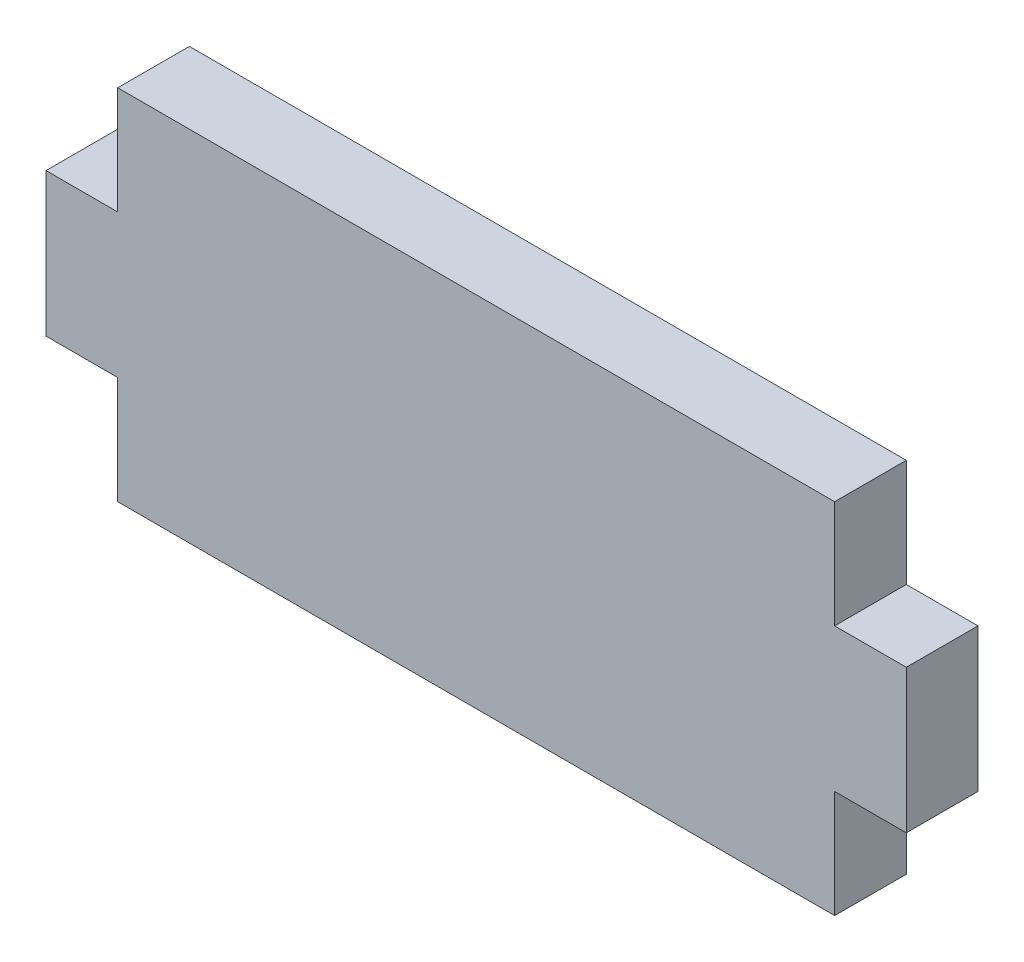
from build123d import *

# Parameters (mm, degrees)
ESQUISSE1_W        = 10
ESQUISSE1_H        = 20
ESQUISSE1_W_2      = 100
ESQUISSE1_H_2      = 50
BOSS_EXTRU_1_DEPTH = 10


with BuildPart() as part:
    # Esquisse1 → Boss.-Extru.1 (new body)
    with BuildSketch(Plane.XY):
        with Locations((-5, 25)):
            Rectangle(ESQUISSE1_W, ESQUISSE1_H)
        with Locations((50, 25)):
            Rectangle(ESQUISSE1_W_2, ESQUISSE1_H_2)
        with Locations((105, 25)):
            Rectangle(ESQUISSE1_W, ESQUISSE1_H)
    extrude(amount=BOSS_EXTRU_1_DEPTH)


solid = part.part
